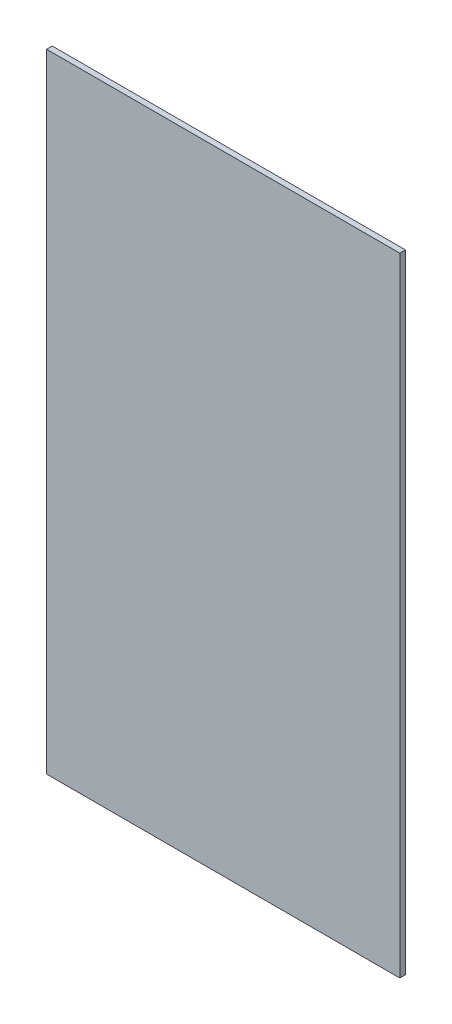
from build123d import *

# Parameters (mm, degrees)
SKETCH1_W           = 398.526
SKETCH1_H           = 708.406
BOSS_EXTRUDE1_DEPTH = 6.35


with BuildPart() as part:
    # Sketch1 → Boss-Extrude1 (new body)
    with BuildSketch(Plane.XY):
        with Locations((171.425548889, 318.632923581)):
            Rectangle(SKETCH1_W, SKETCH1_H)
    extrude(amount=BOSS_EXTRUDE1_DEPTH)


solid = part.part
